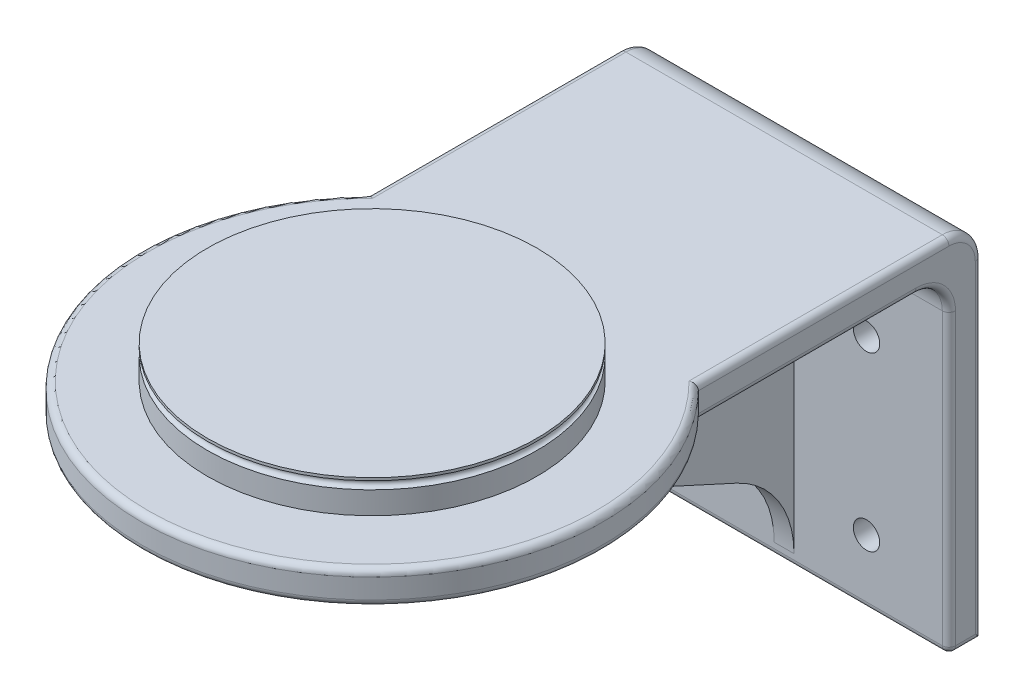
from build123d import *

# Parameters (mm, degrees)
BOSS_EXTRUDE1_DEPTH = 50
SKETCH2_R           = 25
BOSS_EXTRUDE2_DEPTH = 5
SKETCH3_R           = 35
BOSS_EXTRUDE3_DEPTH = 5
CUT_EXTRUDE1_DEPTH  = 154.378616502
BOSS_EXTRUDE5_DEPTH = 1.5
SKETCH8_R           = 2
CUT_EXTRUDE2_DEPTH  = 125.924977486
FILLET1_R           = 5
FILLET2_R           = 5
SKETCH4_R           = 0.6
FILLET3_R           = 15
FILLET4_R           = 15
FILLET5_R           = 1
FILLET6_R           = 1


with BuildPart() as part:
    # Sketch1 → Boss-Extrude1 (new body)
    with BuildSketch(Plane(origin=(0, 0, 0), x_dir=(0, 0, -1), z_dir=(1, 0, 0))):
        Polygon((0, 0), (-130, 0), (-130, 5), (5, 5), (5, -50), (0, -50), align=None)
    extrude(amount=BOSS_EXTRUDE1_DEPTH)

    # Sketch2 → Boss-Extrude2 (add)
    with BuildSketch(Plane(origin=(0, 5, 0), x_dir=(1, 0, 0), z_dir=(0, 1, 0))):
        with Locations(Location((25, -62.5, 0), (0, 0, 180))):
            Circle(SKETCH2_R)
    extrude(amount=BOSS_EXTRUDE2_DEPTH)

    # Sketch3 → Boss-Extrude3 (add)
    with BuildSketch(Plane(origin=(0, 5, 0), x_dir=(1, 0, 0), z_dir=(0, 1, 0))):
        with Locations((25, -62.5)):
            Circle(SKETCH3_R)
    extrude(amount=-BOSS_EXTRUDE3_DEPTH)

    # Sketch5 → Cut-Extrude1 (cut, through all)
    with BuildSketch(Plane(origin=(0, 5, 0), x_dir=(1, 0, 0), z_dir=(0, 1, 0))):
        with BuildLine():
            Line((50, -86.994897428), (70.537022891, -86.994897428))
            Line((70.537022891, -86.994897428), (70.537022891, -135.576876808))
            Line((70.537022891, -135.576876808), (-17.356127909, -135.576876808))
            Line((-17.356127909, -135.576876808), (0, -86.994897428))
            ThreePointArc((0, -86.994897428), (25, -97.5), (50, -86.994897428))
        make_face()
    extrude(amount=-CUT_EXTRUDE1_DEPTH, mode=Mode.SUBTRACT)

    # Sketch7 → Boss-Extrude5 (add, symmetric)
    with BuildSketch(Plane(origin=(25, 0, 0), x_dir=(0, 0, -1), z_dir=(1, 0, 0))):
        Polygon((0, 0), (-84.262202347, 0), (0, -38.514987448), align=None)
    extrude(amount=BOSS_EXTRUDE5_DEPTH, both=True)

    # Sketch8 → Cut-Extrude2 (cut, through all)
    with BuildSketch(Plane.XY):
        with Locations((12.5, -40.20147339)):
            Circle(SKETCH8_R)
        with Locations((12.5, -14.084651438)):
            Circle(SKETCH8_R)
        with Locations((37.5, -40.20147339)):
            Circle(SKETCH8_R)
        with Locations((37.5, -14.084651438)):
            Circle(SKETCH8_R)
    extrude(amount=-CUT_EXTRUDE2_DEPTH, mode=Mode.SUBTRACT)

    # Fillet1
    fillet1_edges = [part.edges().sort_by_distance(p)[0] for p in [
        (38.25, 0, 0),
        (11.75, 0, 0),
    ]]
    fillet(fillet1_edges, radius=FILLET1_R)

    # Fillet2
    fillet2_edges = [part.edges().sort_by_distance(p)[0] for p in [
        (25, 5, -5),
    ]]
    fillet(fillet2_edges, radius=FILLET2_R)

    # Sketch4 → Cut-Revolve1 (revolve, cut)
    with BuildSketch(Plane(origin=(25, 0, 0), x_dir=(0, 0, -1), z_dir=(1, 0, 0))):
        with Locations((-87.5, 9)):
            Circle(SKETCH4_R)
    revolve(axis=Axis((25, 10, 62.5), (0, -1, 0)), mode=Mode.SUBTRACT)

    # Fillet3
    fillet3_edges = [part.edges().sort_by_distance(p)[0] for p in [
        (25, -38.514987448, 0),
    ]]
    fillet(fillet3_edges, radius=FILLET3_R)

    # Fillet4
    fillet4_edges = [part.edges().sort_by_distance(p)[0] for p in [
        (25, 0, 84.262202347),
    ]]
    fillet(fillet4_edges, radius=FILLET4_R)

    # Fillet5
    fillet5_edges = [part.edges().sort_by_distance(p)[0] for p in [
        (25, -50, 0),
    ]]
    fillet(fillet5_edges, radius=FILLET5_R)

    # Fillet6
    fillet6_edges = [part.edges().sort_by_distance(p)[0] for p in [
        (0, -27, 0),
        (50, -27, 0),
        (0, -1.464466094, 1.464466094),
        (50, -1.464466094, 1.464466094),
        (50, 5, 19.002551286),
        (0, 5, 19.002551286),
        (0, 3.535533906, -3.535533906),
        (50, 3.535533906, -3.535533906),
        (50, -25, -5),
        (0, -50, -3),
        (50, -50, -3),
        (0, -49.707106781, -0.292893219),
        (50, -49.707106781, -0.292893219),
        (0, 0, 21.502551286),
        (50, 0, 21.502551286),
        (25, 0, 97.5),
        (25, 5, 97.5),
        (0, -25, -5),
    ]]
    fillet(fillet6_edges, radius=FILLET6_R)


solid = part.part
